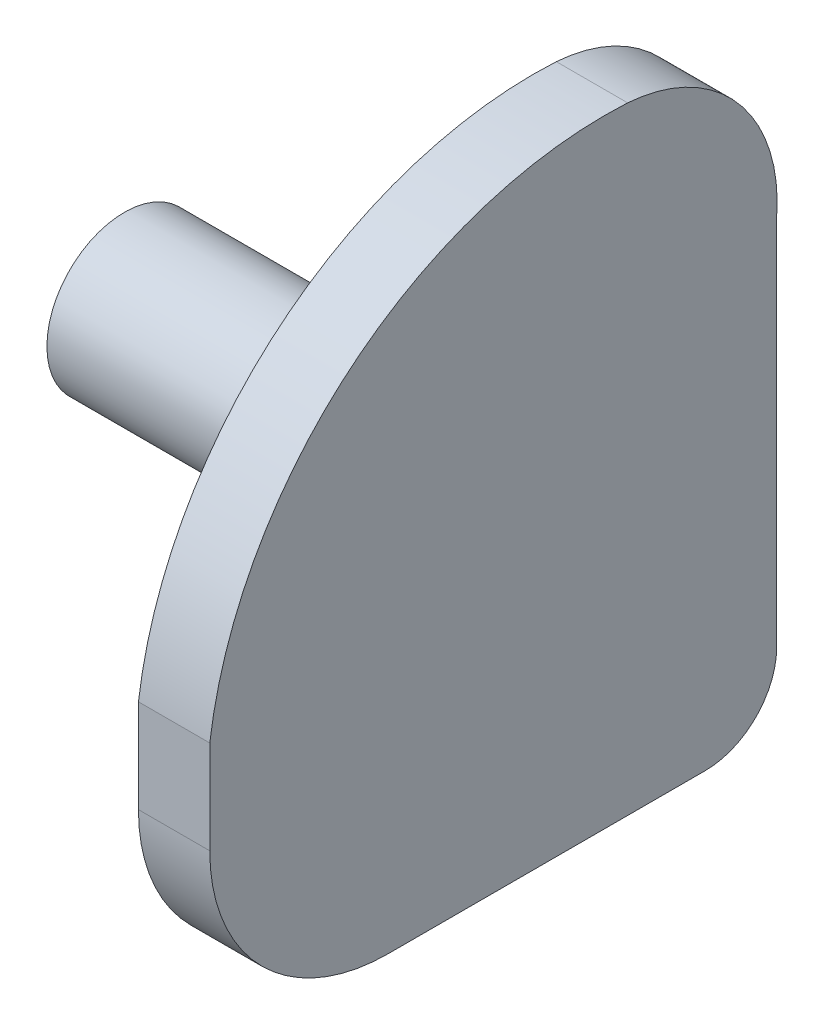
from build123d import *

# Parameters (mm, degrees)
BOSS_EXTRUDE1_DEPTH = 20
SCALE1_SCALE        = 0.110510806
SKETCH5_R           = 2.4
BOSS_EXTRUDE2_DEPTH = 10


with BuildPart() as part:
    # Sketch3 → Boss-Extrude1 (new body)
    with BuildSketch(Plane(origin=(0, 0, 0), x_dir=(0, 0, -1), z_dir=(1, 0, 0))):
        with BuildLine():
            Line((0, -60), (0, -86.184781703))
            ThreePointArc((0, -86.184781703), (14.644660941, -121.540120762), (50, -136.184781703))
            Line((50, -136.184781703), (59.297038535, -136.184781703))
            Line((59.297038535, -136.184781703), (138.939006392, -136.184781703))
            ThreePointArc((138.939006392, -136.184781703), (153.081142016, -130.326917326), (158.939006392, -116.184781703))
            Line((158.939006392, -116.184781703), (158.939006392, -50))
            Line((158.939006392, -50), (158.939006392, -11.480346054))
            ThreePointArc((158.939006392, -11.480346054), (148.053108697, 21.328755123), (117.156078712, 36.830801017))
            ThreePointArc((117.156078712, 36.830801017), (39.60735059, 11.368133348), (0, -60))
        make_face()
    extrude(amount=BOSS_EXTRUDE1_DEPTH)


with BuildPart() as part_1:
    # Scale1: scaled about (10, -55.771836123, -85.371281571)
    add(part.part.scale(SCALE1_SCALE).moved(Location((8.89489194, -49.608445561, -75.936832435))))

    # Sketch5 → Boss-Extrude2 (add)
    with BuildSketch(Plane.ZY.offset(-8.89489194)):
        with Locations((-85.501310137, -55.288244055)):
            Circle(SKETCH5_R)
    extrude(amount=BOSS_EXTRUDE2_DEPTH)


solid = part_1.part
